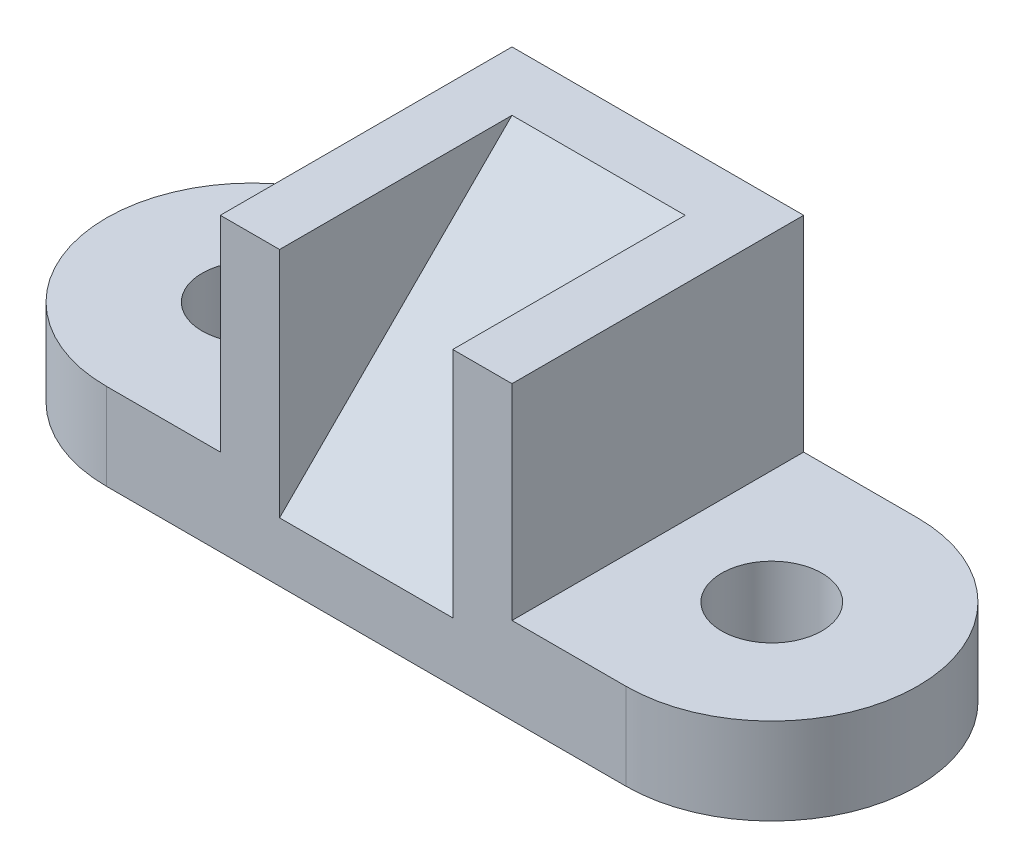
from build123d import *

# Parameters (mm, degrees)
SKETCH1_R           = 11
BOSS_EXTRUDE1_DEPTH = 19
SKETCH2_W           = 64
SKETCH2_H           = 64
BOSS_EXTRUDE2_DEPTH = 45
CUT_EXTRUDE5_DEPTH  = 19


with BuildPart() as part:
    # Sketch1 → Boss-Extrude1 (new body)
    with BuildSketch(Plane(origin=(0, 0, 0), x_dir=(1, 0, 0), z_dir=(0, 1, 0))):
        with BuildLine():
            Line((0, 32), (114, 32))
            ThreePointArc((114, 32), (146, 0), (114, -32))
            Line((114, -32), (0, -32))
            ThreePointArc((0, -32), (-32, 0), (0, 32))
        make_face()
        with Locations(Location((0, 0, 0), (0, 0, 270))):
            Circle(SKETCH1_R, mode=Mode.SUBTRACT)
        with Locations(Location((114, 0, 0), (0, 0, 270))):
            Circle(SKETCH1_R, mode=Mode.SUBTRACT)
    extrude(amount=BOSS_EXTRUDE1_DEPTH)

    # Sketch2 → Boss-Extrude2 (add)
    with BuildSketch(Plane(origin=(0, 19, 0), x_dir=(1, 0, 0), z_dir=(0, 1, 0))):
        with Locations((57, 0)):
            Rectangle(SKETCH2_W, SKETCH2_H)
    extrude(amount=BOSS_EXTRUDE2_DEPTH)

    # Sketch4 → Cut-Extrude5 (cut, symmetric)
    with BuildSketch(Plane(origin=(57, 0, 0), x_dir=(0, 0, -1), z_dir=(1, 0, 0))):
        Polygon((-32, 64), (19, 64), (-32, 13), align=None)
    extrude(amount=CUT_EXTRUDE5_DEPTH, both=True, mode=Mode.SUBTRACT)


solid = part.part
